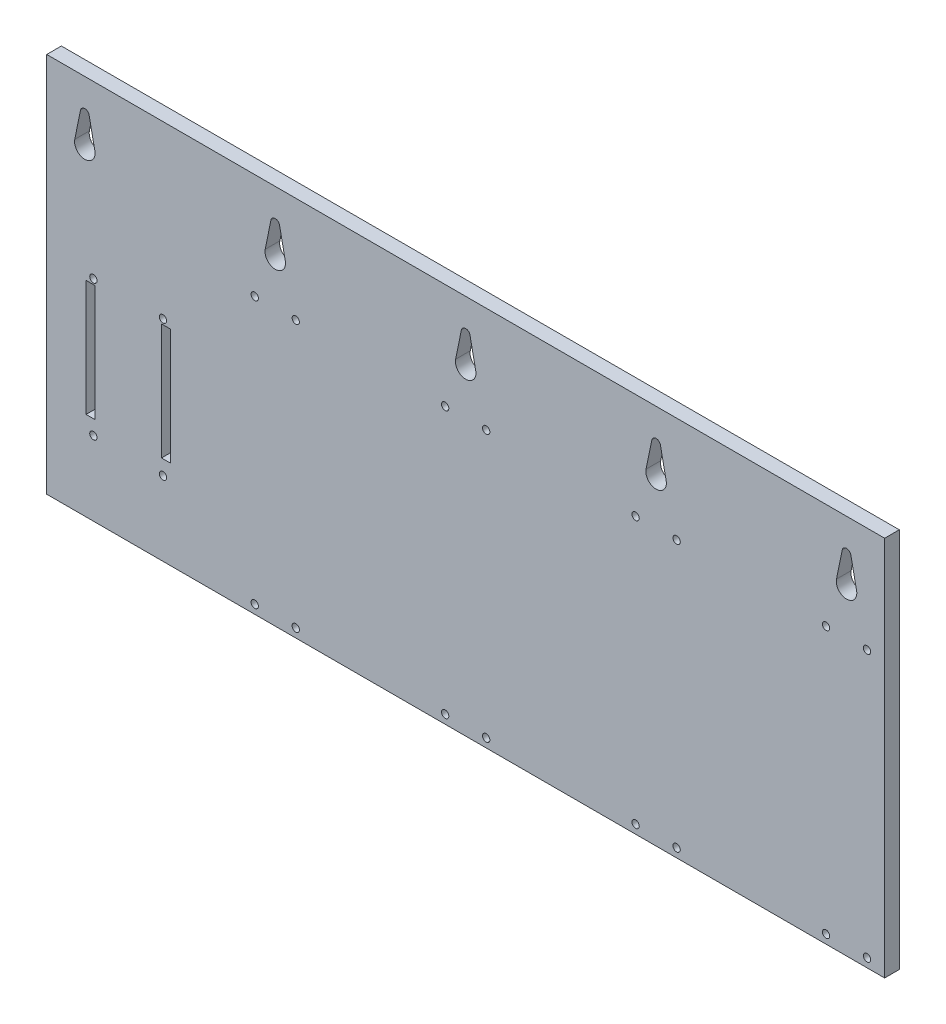
from build123d import *

# Parameters (mm, degrees)
SKETCH_1_W         = 221
SKETCH_1_H         = 130
EXTRUDE_1_DEPTH    = 5
HOLE_WIZARD_M3_1_D = 2.5
SKETCH_4_W         = 65
SKETCH_4_H         = 130
SKETCH_4_W_2       = 3
SKETCH_4_H_2       = 39.63
EXTRUDE_3_DEPTH    = 5
HOLE_WIZARD_M3_2_D = 2.5


with BuildPart() as part:
    # 草圖1 → 填料-伸長1 (new body)
    with BuildSketch(Plane.XY):
        with Locations((0, 16.5)):
            Rectangle(SKETCH_1_W, SKETCH_1_H)
        with BuildLine():
            ThreePointArc((98.969693846, 70.8), (97.5, 72), (96.030306154, 70.8))
            Line((96.030306154, 70.8), (94.07071436, 61.2))
            ThreePointArc((94.07071436, 61.2), (97.5, 57), (100.92928564, 61.2))
            Line((100.92928564, 61.2), (98.969693846, 70.8))
        make_face(mode=Mode.SUBTRACT)
        with BuildLine():
            ThreePointArc((33.969693846, 70.8), (32.5, 72), (31.030306154, 70.8))
            Line((31.030306154, 70.8), (29.07071436, 61.2))
            ThreePointArc((29.07071436, 61.2), (32.5, 57), (35.92928564, 61.2))
            Line((35.92928564, 61.2), (33.969693846, 70.8))
        make_face(mode=Mode.SUBTRACT)
        with BuildLine():
            ThreePointArc((-31.030306154, 70.8), (-32.5, 72), (-33.969693846, 70.8))
            Line((-33.969693846, 70.8), (-35.92928564, 61.2))
            ThreePointArc((-35.92928564, 61.2), (-32.5, 57), (-29.07071436, 61.2))
            Line((-29.07071436, 61.2), (-31.030306154, 70.8))
        make_face(mode=Mode.SUBTRACT)
        with BuildLine():
            ThreePointArc((-100.92928564, 61.2), (-97.5, 57), (-94.07071436, 61.2))
            Line((-94.07071436, 61.2), (-96.030306154, 70.8))
            ThreePointArc((-96.030306154, 70.8), (-97.5, 72), (-98.969693846, 70.8))
            Line((-98.969693846, 70.8), (-100.92928564, 61.2))
        make_face(mode=Mode.SUBTRACT)
    extrude(amount=-EXTRUDE_1_DEPTH)

    # M3 螺紋孔1 (through all)
    with Locations(Plane.XY):
        with Locations((-104.5, 45.5), (-90.5, 45.5), (-104.5, -45.5), (-90.5, -45.5), (-39.5, 45.5), (-25.5, 45.5), (-25.5, -45.5), (-39.5, -45.5), (25.5, 45.5), (39.5, 45.5), (39.5, -45.5), (25.5, -45.5), (90.5, 45.5), (104.5, 45.5), (104.5, -45.5), (90.5, -45.5)):
            Hole(HOLE_WIZARD_M3_1_D / 2)

    # 草圖4 → 填料-伸長3 (add)
    with BuildSketch(Plane.XY):
        with Locations((-143, 16.5)):
            Rectangle(SKETCH_4_W, SKETCH_4_H)
        with Locations((-160.568887464, 1.625)):
            Rectangle(SKETCH_4_W_2, SKETCH_4_H_2, mode=Mode.SUBTRACT)
        with Locations((-134.818887464, 1.625)):
            Rectangle(SKETCH_4_W_2, SKETCH_4_H_2, mode=Mode.SUBTRACT)
        with BuildLine():
            ThreePointArc((-163.969693846, 70.8), (-162.5, 72), (-161.030306154, 70.8))
            Line((-161.030306154, 70.8), (-159.07071436, 61.2))
            ThreePointArc((-159.07071436, 61.2), (-162.5, 57), (-165.92928564, 61.2))
            Line((-165.92928564, 61.2), (-163.969693846, 70.8))
        make_face(mode=Mode.SUBTRACT)
    extrude(amount=-EXTRUDE_3_DEPTH)

    # M3 螺紋孔2 (through all)
    with Locations(Plane.XY):
        with Locations((-159.568887464, 23.19), (-135.818887464, 23.19), (-159.568887464, -23.19), (-135.818887464, -23.19)):
            Hole(HOLE_WIZARD_M3_2_D / 2)


solid = part.part
